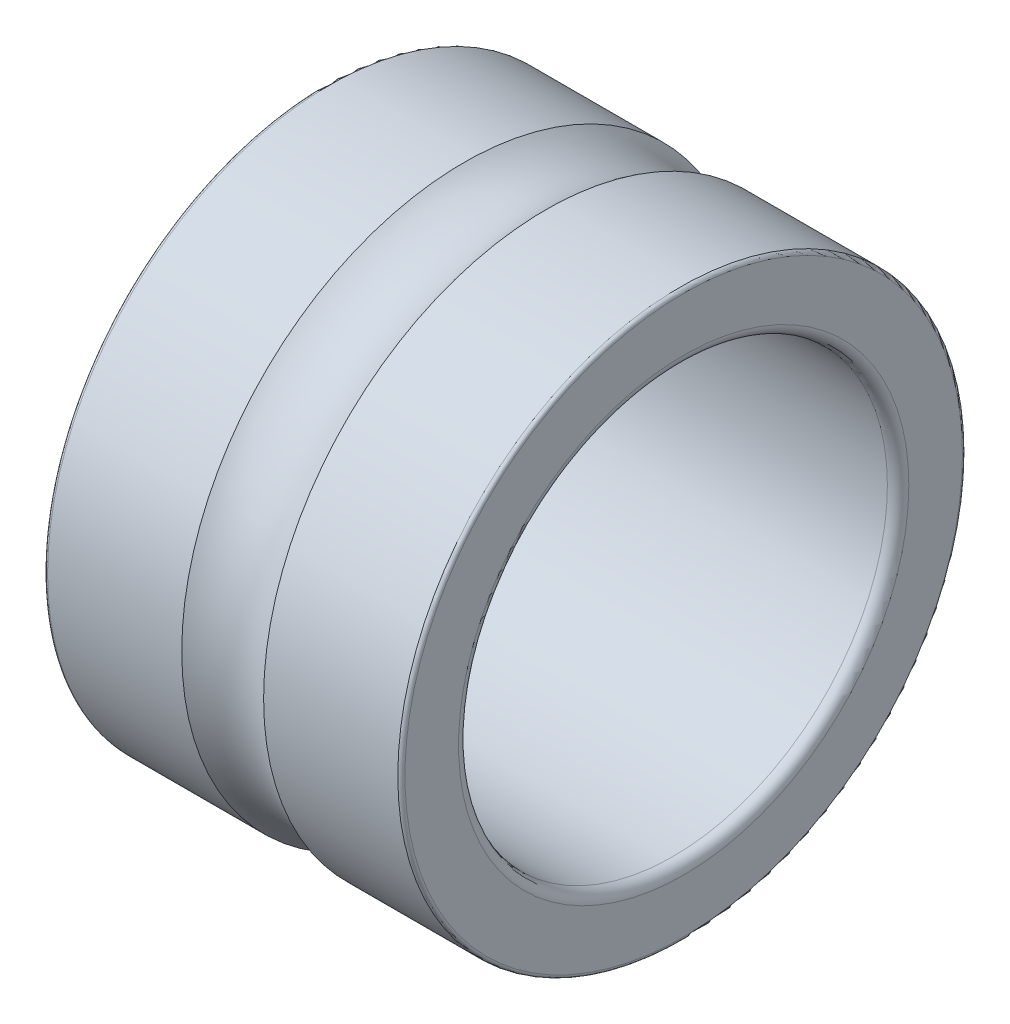
from build123d import *


with BuildPart() as part:
    # Sketch1 → Revolve1 (revolve)
    with BuildSketch(Plane.XY, mode=Mode.PRIVATE) as revolve1_sk:
        with BuildLine():
            Line((0, 3.9), (0, 3.15))
            ThreePointArc((0, 3.15), (0.043933983, 3.043933983), (0.15, 3))
            Line((0.15, 3), (4.85, 3))
            ThreePointArc((4.85, 3), (4.956066017, 3.043933983), (5, 3.15))
            Line((5, 3.15), (5, 3.9))
            ThreePointArc((5, 3.9), (4.985355339, 3.935355339), (4.95, 3.95))
            Line((4.95, 3.95), (3.072681412, 3.95))
            ThreePointArc((3.072681412, 3.95), (2.5, 3.768), (1.927318588, 3.95))
            Line((1.927318588, 3.95), (0.05, 3.95))
            ThreePointArc((0.05, 3.95), (0.014644661, 3.935355339), (0, 3.9))
        make_face()
    revolve(revolve1_sk.sketch.rotate(Axis((4.85, 0, 0), (-1, 0, 0)), 90), axis=Axis((4.85, 0, 0), (-1, 0, 0)))


solid = part.part
